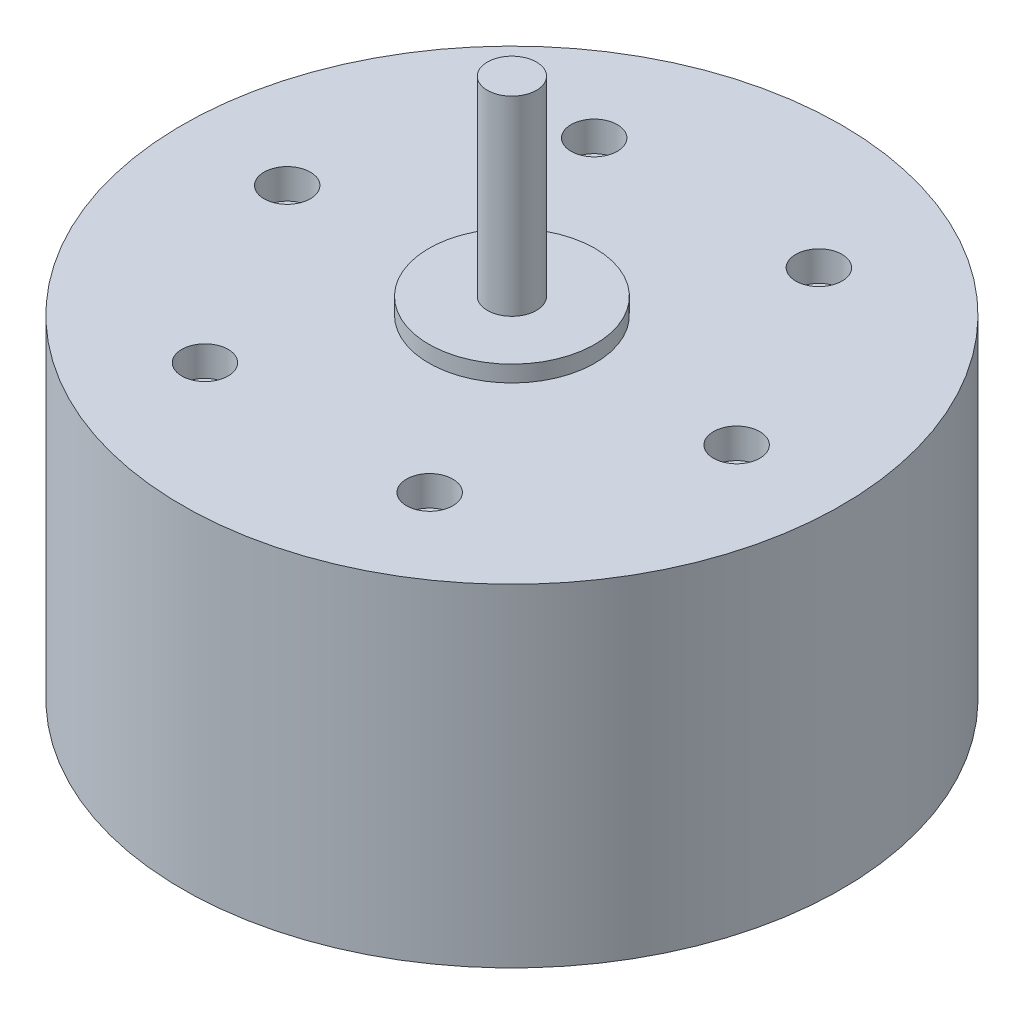
from build123d import *

# Parameters (mm, degrees)
SKETCH2_R          = 0.85
CUT_EXTRUDE1_DEPTH = 1.1


with BuildPart() as part:
    # Sketch1 → Revolve1 (revolve)
    with BuildSketch(Plane.XY, mode=Mode.PRIVATE) as revolve1_sk:
        Polygon((0, -10.15), (0, 10.15), (0.9, 10.15), (0.9, 3.15), (3.05, 3.15), (3.05, 2.55), (12.1, 2.55), (12.1, -9.65), (11.9, -9.65), (11.9, -9.05), (2.85, -9.05), (2.85, -10.15), align=None)
    revolve(revolve1_sk.sketch.rotate(Axis((0, -11.843181818, 0), (0, 1, 0)), 90), axis=Axis((0, -11.843181818, 0), (0, 1, 0)))

    # Sketch2 → Cut-Extrude1 (cut)
    with BuildSketch(Plane(origin=(0, 2.55, 0), x_dir=(1, 0, 0), z_dir=(0, 1, 0))):
        with Locations(Location((-8.25, 0, 0), (0, 0, 270))):
            Circle(SKETCH2_R)
        with Locations(Location((-4.125, 7.144709581, 0), (0, 0, 270))):
            Circle(SKETCH2_R)
        with Locations(Location((4.125, 7.144709581, 0), (0, 0, 270))):
            Circle(SKETCH2_R)
        with Locations(Location((8.25, 0, 0), (0, 0, 270))):
            Circle(SKETCH2_R)
        with Locations(Location((4.125, -7.144709581, 0), (0, 0, 270))):
            Circle(SKETCH2_R)
        with Locations(Location((-4.125, -7.144709581, 0), (0, 0, 270))):
            Circle(SKETCH2_R)
    extrude(amount=-CUT_EXTRUDE1_DEPTH, mode=Mode.SUBTRACT)


solid = part.part
